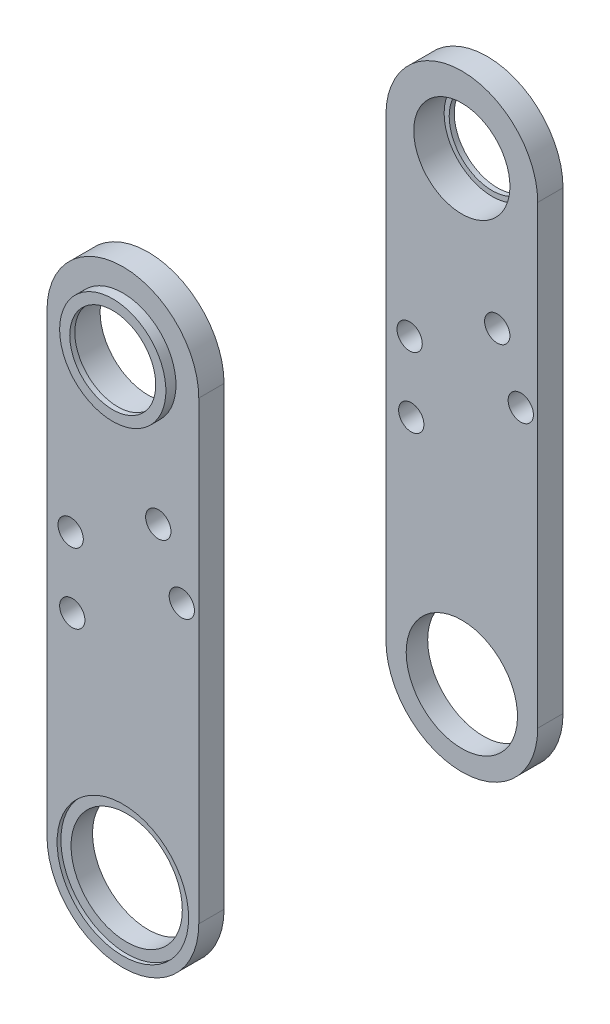
from build123d import *
from build123d.topology import SkipClean

# Parameters (mm, degrees)
SKETCH_1_R               = 11
SKETCH_1_R_2             = 9.5
EXTRUDE_1_DEPTH          = 72
SKETCH_2_W               = 62
SKETCH_2_H               = 70
SKETCH_2_H_2             = 67.94057246
CUT_EXTRUDE_1_DEPTH      = 70
EXTRUDE_2_DEPTH          = 62
EXTRUDE_3_DEPTH          = 62
CUT_EXTRUDE_3_DEPTH      = 130.811063026
CUT_EXTRUDE_3_DEPTH_BACK = 130.811063026
SKETCH_6_R               = 2.5
CUT_EXTRUDE_4_DEPTH      = 136.359998088
CUT_EXTRUDE_4_DEPTH_BACK = 136.359998088
SKETCH_7_W               = 62
SKETCH_7_H               = 120
SKETCH_8_R               = 13
CUT_EXTRUDE_5_DEPTH      = 0.75
SKETCH_9_R               = 13
CUT_EXTRUDE_6_DEPTH      = 0.75


with BuildPart() as part:
    # 草图1 → 凸台-拉伸1 (new body)
    with BuildSketch(Plane.XY):
        with BuildLine():
            Line((-15, 90), (-15, 0))
            ThreePointArc((-15, 0), (0, -15), (15, 0))
            Line((15, 0), (15, 90))
            ThreePointArc((15, 90), (0, 105), (-15, 90))
        make_face()
        Circle(SKETCH_1_R, mode=Mode.SUBTRACT)
        with Locations((0, 90)):
            Circle(SKETCH_1_R_2, mode=Mode.SUBTRACT)
    extrude(amount=EXTRUDE_1_DEPTH)

    # 草图2 → 切除-拉伸1 (cut)
    with BuildSketch(Plane.ZY.offset(15)):
        with Locations((36, 80)):
            Rectangle(SKETCH_2_W, SKETCH_2_H)
        with Locations((36, 11.02971377)):
            Rectangle(SKETCH_2_W, SKETCH_2_H_2)
    extrude(amount=-CUT_EXTRUDE_1_DEPTH, mode=Mode.SUBTRACT)


with BuildPart() as cut_extrude_1_piece_1:
    # of the separate pieces the step leaves, piece 1, a body of its own (cut_extrude_1_pieces)
    add(part.part.solids().sort_by_distance((15, 0, 0))[0])



with BuildPart() as cut_extrude_1_piece_2:
    # of the separate pieces the step leaves, piece 2, a body of its own (cut_extrude_1_pieces)
    add(part.part.solids().sort_by_distance((15, 0, 67))[0])


with BuildPart() as cut_extrude_1_piece_1_1:
    add(cut_extrude_1_piece_1.part)

    add(cut_extrude_1_piece_2.part)  # 凸台-拉伸2 merges 切除-拉伸1 piece 2
    # 草图4 → 凸台-拉伸2 (add)
    with BuildSketch(Plane(origin=(0, 0, 67), x_dir=(-1, 0, 0), z_dir=(0, 0, -1))):
        with BuildLine():
            Line((-4.490156776, 68.758657712), (15, 57.50601045))
            Line((15, 57.50601045), (36.319312502, 12.911360415))
            ThreePointArc((36.319312502, 12.911360415), (35.142094618, 9.577570071), (31.808304274, 10.754787955))
            Line((31.808304274, 10.754787955), (15, 45.913541163))
            Line((15, 45.913541163), (-9.509843224, 60.064305746))
            ThreePointArc((-9.509843224, 60.064305746), (-11.347175983, 66.921324953), (-4.490156776, 68.758657712))
        make_face()
    extrude(amount=EXTRUDE_2_DEPTH)

    # 草图5 → 凸台-拉伸3 (add)
    with BuildSketch(Plane(origin=(0, 0, 67), x_dir=(-1, 0, 0), z_dir=(0, 0, -1))):
        with BuildLine():
            Line((-30.017605928, 49.094069219), (-15, 60.919508718))
            Line((-15, 60.919508718), (12.5, 45.042376315))
            ThreePointArc((12.5, 45.042376315), (14.330127019, 38.212249296), (7.5, 36.382122277))
            Line((7.5, 36.382122277), (-15, 49.372503334))
            Line((-15, 49.372503334), (-27.615908762, 44.780688066))
            ThreePointArc((-27.615908762, 44.780688066), (-30.655195979, 45.913733224), (-30.017605928, 49.094069219))
        make_face()
    extrude(amount=EXTRUDE_3_DEPTH)

    # 草图6 → 切除-拉伸3 (cut, two sides: drawn at the far end of the back side and taken through both)
    with BuildSketch(Plane(origin=(0, 0, 67), x_dir=(-1, 0, 0), z_dir=(0, 0, -1)).offset(-CUT_EXTRUDE_3_DEPTH_BACK)):
        with Locations(Location((-7, 64.411481729, 0), (0, 0, 90))):
            Circle(SKETCH_6_R)
        with Locations(Location((-11.650635095, 53.212249296, 0), (0, 0, 90))):
            Circle(SKETCH_6_R)
        with Locations(Location((10, 40.712249296, 0), (0, 0, 90))):
            Circle(SKETCH_6_R)
        with Locations(Location((10.320508076, 54.411481729, 0), (0, 0, 90))):
            Circle(SKETCH_6_R)
    extrude(amount=CUT_EXTRUDE_3_DEPTH + CUT_EXTRUDE_3_DEPTH_BACK, mode=Mode.SUBTRACT)

    # 草图7 → 切除-拉伸4 (cut, two sides: drawn at the far end of the back side and taken through both)
    with BuildSketch(Plane.ZY.offset(15).offset(-CUT_EXTRUDE_4_DEPTH_BACK)):
        with Locations((36, 45)):
            Rectangle(SKETCH_7_W, SKETCH_7_H)
    extrude(amount=CUT_EXTRUDE_4_DEPTH + CUT_EXTRUDE_4_DEPTH_BACK, mode=Mode.SUBTRACT)


with BuildPart() as cut_extrude_4_piece_1:
    # of the separate pieces the step leaves, piece 1, a body of its own (cut_extrude_4_pieces)
    add(cut_extrude_1_piece_1_1.part.solids().sort_by_distance((-15, 90, 5))[0])

    # 草图9 → 切除-拉伸6 (cut)
    with BuildSketch(Plane(origin=(0, 0, 0), x_dir=(-1, 0, 0), z_dir=(0, 0, -1))):
        Circle(SKETCH_9_R)
    extrude(amount=-CUT_EXTRUDE_6_DEPTH, mode=Mode.SUBTRACT)



with BuildPart() as cut_extrude_4_piece_2:
    # of the separate pieces the step leaves, piece 2, a body of its own (cut_extrude_4_pieces)
    add(cut_extrude_1_piece_1_1.part.solids().sort_by_distance((15, 0, 67))[0])

    # 草图8 → 切除-拉伸5 (cut)
    with BuildSketch(Plane.XY.offset(72)):
        Circle(SKETCH_8_R)
    extrude(amount=-CUT_EXTRUDE_5_DEPTH, mode=Mode.SUBTRACT)


with BuildPart() as cut_extrude_4_piece_1_1:
    with SkipClean():  # the faces are left unmerged after this step: merging them gives an invalid solid
        add(cut_extrude_4_piece_1.part)

        add(cut_extrude_4_piece_2.part)  # 旋转1 merges 切除-拉伸4 piece 2
        # 草图10 → 旋转1 (revolve)
        with BuildSketch(Plane(origin=(0, 0, 0), x_dir=(0, 0, -1), z_dir=(1, 0, 0)), mode=Mode.PRIVATE) as revolve_1_sk:
            Polygon((0, 79.5), (2, 79.5), (2, 81.5), (1, 81.5), (1, 80.5), (0, 80.5), align=None)
            Polygon((-72, 79.5), (-74, 79.5), (-74, 81.5), (-73, 81.5), (-73, 80.5), (-72, 80.5), align=None)
        revolve(revolve_1_sk.sketch.rotate(Axis((0, 90, 67), (0, 0, 1)), 270), axis=Axis((0, 90, 67), (0, 0, 1)))


solid = cut_extrude_4_piece_1_1.part
